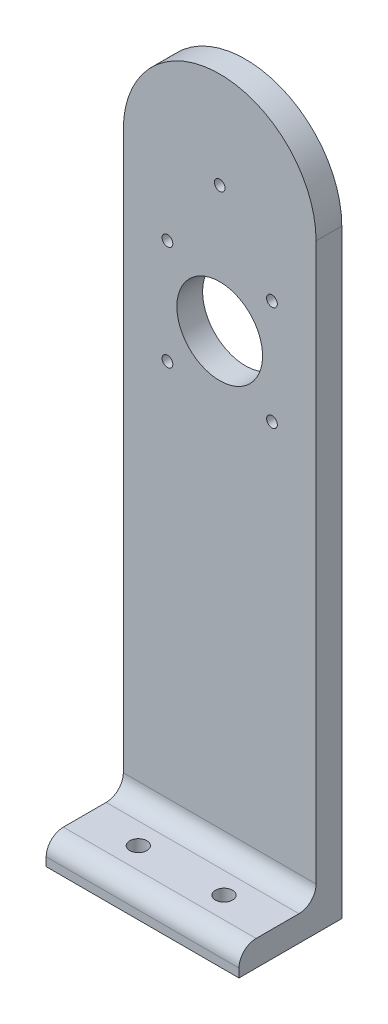
from build123d import *

# Parameters (mm, degrees)
BOSS_EXTRUDE1_DEPTH = 7.62
BOSS_EXTRUDE2_DEPTH = 57.15
FILLET1_R           = 5.08
SKETCH3_R           = 2.54
CUT_EXTRUDE1_DEPTH  = 204.09877166
SKETCH4_R           = 1.5875
CUT_EXTRUDE2_DEPTH  = 183.642823634
SKETCH5_R           = 12.7
CUT_EXTRUDE3_DEPTH  = 183.642823634
SKETCH7_R           = 1.5875
CUT_EXTRUDE4_DEPTH  = 183.642823634


with BuildPart() as part:
    # Sketch1 → Boss-Extrude1 (new body)
    with BuildSketch(Plane.XY):
        with BuildLine():
            Line((-28.575, 0), (-28.575, -177.8))
            Line((-28.575, -177.8), (28.575, -177.8))
            Line((28.575, -177.8), (28.575, 0))
            ThreePointArc((28.575, 0), (0, 28.575), (-28.575, 0))
        make_face()
    extrude(amount=BOSS_EXTRUDE1_DEPTH)

    # Sketch2 → Boss-Extrude2 (add, through all)
    with BuildSketch(Plane.ZY.offset(28.575)):
        with BuildLine():
            Line((0, -177.8), (30.48, -177.8))
            Line((30.48, -177.8), (30.48, -175.26))
            ThreePointArc((30.48, -175.26), (28.992102448, -171.667897552), (25.4, -170.18))
            Line((25.4, -170.18), (0, -170.18))
            Line((0, -170.18), (0, -177.8))
        make_face()
    extrude(amount=-BOSS_EXTRUDE2_DEPTH)

    # Fillet1
    fillet1_edges = [part.edges().sort_by_distance(p)[0] for p in [
        (0, -170.18, 7.62),
    ]]
    fillet(fillet1_edges, radius=FILLET1_R)

    # Sketch3 → Cut-Extrude1 (cut, through all)
    with BuildSketch(Plane(origin=(0, -170.18, 0), x_dir=(1, 0, 0), z_dir=(0, 1, 0))):
        with Locations(Location((12.7, -19.05, 0), (0, 0, 180))):
            Circle(SKETCH3_R)
        with Locations(Location((-12.7, -19.05, 0), (0, 0, 180))):
            Circle(SKETCH3_R)
    extrude(amount=-CUT_EXTRUDE1_DEPTH, mode=Mode.SUBTRACT)

    # Sketch4 → Cut-Extrude2 (cut, through all)
    with BuildSketch(Plane(origin=(0, 0, 0), x_dir=(-1, 0, 0), z_dir=(0, 0, -1))):
        Circle(SKETCH4_R)
    extrude(amount=-CUT_EXTRUDE2_DEPTH, mode=Mode.SUBTRACT)

    # Sketch5 → Cut-Extrude3 (cut, through all)
    with BuildSketch(Plane(origin=(0, 0, 0), x_dir=(-1, 0, 0), z_dir=(0, 0, -1))):
        with Locations((0, -37.465)):
            Circle(SKETCH5_R)
    extrude(amount=-CUT_EXTRUDE3_DEPTH, mode=Mode.SUBTRACT)

    # Sketch7 → Cut-Extrude4 (cut, through all)
    with BuildSketch(Plane(origin=(0, 0, 0), x_dir=(-1, 0, 0), z_dir=(0, 0, -1))):
        with Locations((-15.494, -21.971)):
            Circle(SKETCH7_R)
        with Locations((15.494, -21.971)):
            Circle(SKETCH7_R)
        with Locations((15.494, -52.959)):
            Circle(SKETCH7_R)
        with Locations((-15.494, -52.959)):
            Circle(SKETCH7_R)
    extrude(amount=-CUT_EXTRUDE4_DEPTH, mode=Mode.SUBTRACT)


solid = part.part
